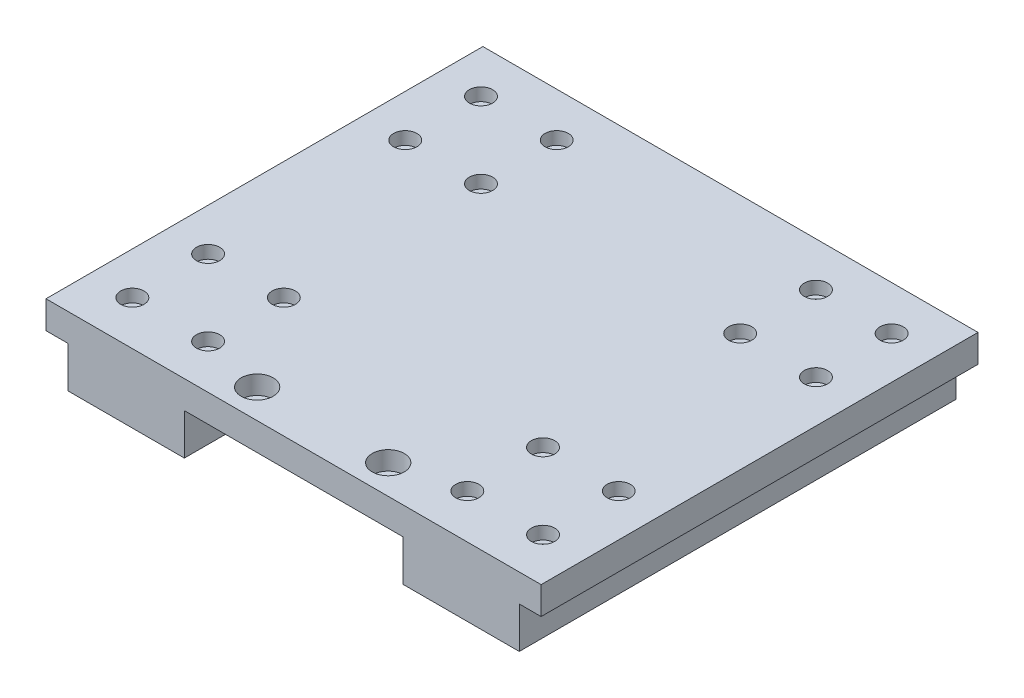
from build123d import *

# Parameters (mm, degrees)
BOSS_EXTRUDE1_DEPTH                                 = 150
CBORE_FOR_M4_HEX_SOCKET_HEAD_CAP_SCREW1_D           = 4.5
CBORE_FOR_M4_HEX_SOCKET_HEAD_CAP_SCREW1_CBORE_D     = 8
CBORE_FOR_M4_HEX_SOCKET_HEAD_CAP_SCREW1_CBORE_DEPTH = 4.4
MIRROR3_COPY_1_D                                    = 4.5
MIRROR3_COPY_1_CBORE_D                              = 8
MIRROR3_COPY_1_CBORE_DEPTH                          = 4.4
CBORE_FOR_M6_HEX_SOCKET_HEAD_CAP_SCREW1_D           = 6.6
CBORE_FOR_M6_HEX_SOCKET_HEAD_CAP_SCREW1_DEPTH       = 23.63
CBORE_FOR_M6_HEX_SOCKET_HEAD_CAP_SCREW1_CBORE_D     = 11
CBORE_FOR_M6_HEX_SOCKET_HEAD_CAP_SCREW1_CBORE_DEPTH = 6.4


with BuildPart() as part:
    # Sketch1 → Boss-Extrude1 (new body)
    with BuildSketch(Plane.XY):
        Polygon((-37.5, 0), (37.5, 0), (37.5, -14.13), (77.5, -14.13), (77.5, 0), (85, 0), (85, 9.5), (-85, 9.5), (-85, 0), (-77.5, 0), (-77.5, -14.13), (-37.5, -14.13), align=None)
    extrude(amount=BOSS_EXTRUDE1_DEPTH)

    # CBORE for M4 Hex Socket Head Cap Screw1 (through all)
    with Locations(Plane(origin=(-5.289478712, 9.5, 140.046555309), x_dir=(1, 0, 0), z_dir=(0, 1, 0))):
        with Locations((75.789478712, 31.196555309), (49.789478712, 5.196555309), (49.789478712, 31.196555309), (75.789478712, 5.196555309)):
            cbore_for_m4_hex_socket_head_cap_screw1 = CounterBoreHole(CBORE_FOR_M4_HEX_SOCKET_HEAD_CAP_SCREW1_D / 2, CBORE_FOR_M4_HEX_SOCKET_HEAD_CAP_SCREW1_CBORE_D / 2, CBORE_FOR_M4_HEX_SOCKET_HEAD_CAP_SCREW1_CBORE_DEPTH)

    # Mirror2: CBORE for M4 Hex Socket Head Cap Screw1 across plane
    add(cbore_for_m4_hex_socket_head_cap_screw1.mirror(Plane(origin=(0, 0, 0), x_dir=(0, 0, 1), z_dir=(1, 0, 0))), mode=Mode.SUBTRACT)

    # Mirror3: CBORE for M4 Hex Socket Head Cap Screw1 across plane
    add(cbore_for_m4_hex_socket_head_cap_screw1.mirror(Plane.XY.offset(75)), mode=Mode.SUBTRACT)

    # Mirror3 copy 1 (through all)
    with Locations(Plane(origin=(5.289478712, 9.5, 9.953444691), x_dir=(-1, 0, 0), z_dir=(0, 1, 0))):
        with Locations((75.789478712, 31.196555309), (49.789478712, 5.196555309), (49.789478712, 31.196555309), (75.789478712, 5.196555309)):
            CounterBoreHole(MIRROR3_COPY_1_D / 2, MIRROR3_COPY_1_CBORE_D / 2, MIRROR3_COPY_1_CBORE_DEPTH)

    # CBORE for M6 Hex Socket Head Cap Screw1
    with Locations(Plane(origin=(-5.289478712, 9.5, 140.046555309), x_dir=(1, 0, 0), z_dir=(0, 1, 0))):
        with Locations((27.789478712, 0.046555309), (-17.210521288, 0.046555309)):
            CounterBoreHole(CBORE_FOR_M6_HEX_SOCKET_HEAD_CAP_SCREW1_D / 2, CBORE_FOR_M6_HEX_SOCKET_HEAD_CAP_SCREW1_CBORE_D / 2, CBORE_FOR_M6_HEX_SOCKET_HEAD_CAP_SCREW1_CBORE_DEPTH, depth=CBORE_FOR_M6_HEX_SOCKET_HEAD_CAP_SCREW1_DEPTH)


solid = part.part
